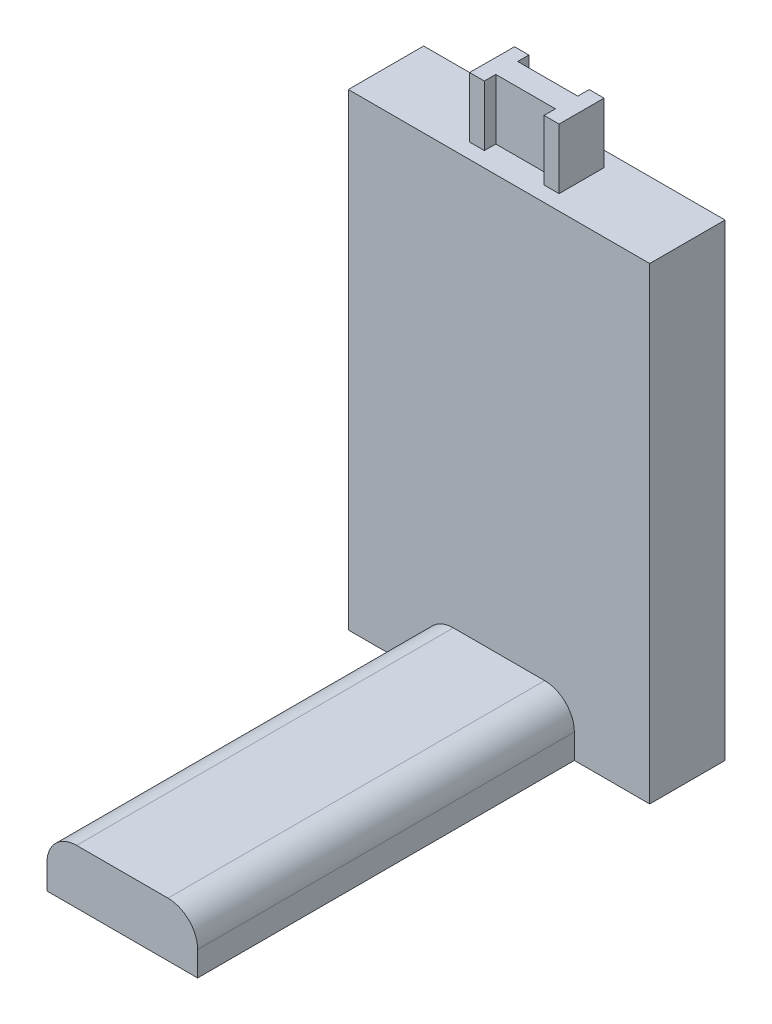
from build123d import *

# Parameters (mm, degrees)
SKETCH3_W           = 101.6
SKETCH3_H           = 25.4
BOSS_EXTRUDE1_DEPTH = 157.8
BOSS_EXTRUDE4_DEPTH = 20.32
SKETCH7_R           = 5.207
CUT_EXTRUDE1_DEPTH  = 17.78
SKETCH8_W           = 50.8
SKETCH8_H           = 18.321584398
BOSS_EXTRUDE5_DEPTH = 127
FILLET1_R           = 10
FILLET2_R           = 10


with BuildPart() as part:
    # Sketch3 → Boss-Extrude1 (new body)
    with BuildSketch(Plane(origin=(0, 0, 0), x_dir=(1, 0, 0), z_dir=(0, 1, 0))):
        with Locations((25.4, 12.7)):
            Rectangle(SKETCH3_W, SKETCH3_H)
    extrude(amount=BOSS_EXTRUDE1_DEPTH)

    # Sketch6 → Boss-Extrude4 (add)
    with BuildSketch(Plane(origin=(0, 157.8, 0), x_dir=(1, 0, 0), z_dir=(0, 1, 0))):
        Polygon((10.447692892, 20.189678665), (15.293534065, 20.189678665), (15.293534065, 16.409589502), (35.527040487, 16.409589502), (35.527040487, 20.263619063), (40.533430612, 20.263619063), (40.533430612, 5.114574025), (35.460110097, 5.114574025), (35.460110097, 8.942217594), (15.367197577, 8.942217594), (15.367197577, 5.087318386), (10.388766814, 5.087318386), align=None)
    extrude(amount=BOSS_EXTRUDE4_DEPTH)

    # Sketch7 → Cut-Extrude1 (cut)
    with BuildSketch(Plane(origin=(0, 0, 0), x_dir=(-1, 0, 0), z_dir=(0, -1, 0))):
        with Locations(Location((5.08, 12.7, 0), (0, 0, 90))):
            Circle(SKETCH7_R)
        with Locations(Location((-55.88, 12.7, 0), (0, 0, 90))):
            Circle(SKETCH7_R)
    extrude(amount=-CUT_EXTRUDE1_DEPTH, mode=Mode.SUBTRACT)

    # Sketch8 → Boss-Extrude5 (add)
    with BuildSketch(Plane.XY):
        with Locations((25.4, 9.160792199)):
            Rectangle(SKETCH8_W, SKETCH8_H)
    extrude(amount=BOSS_EXTRUDE5_DEPTH)

    # Fillet1
    fillet1_edges = [part.edges().sort_by_distance(p)[0] for p in [
        (50.8, 18.321584398, 63.5),
    ]]
    fillet(fillet1_edges, radius=FILLET1_R)

    # Fillet2
    fillet2_edges = [part.edges().sort_by_distance(p)[0] for p in [
        (0, 18.321584398, 63.5),
    ]]
    fillet(fillet2_edges, radius=FILLET2_R)


solid = part.part
